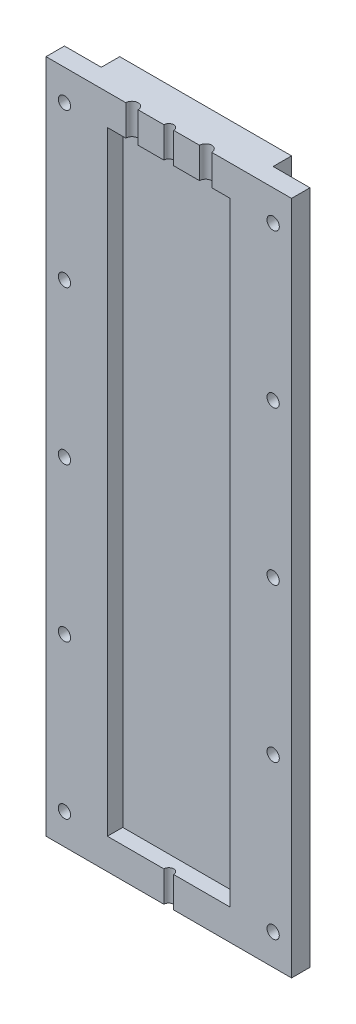
from build123d import *

# Parameters (mm, degrees)
SKETCH1_W           = 28
SKETCH1_H           = 6
BOSS_EXTRUDE1_DEPTH = 105
SKETCH2_W           = 20
SKETCH2_H           = 5
CUT_EXTRUDE1_DEPTH  = 100
SKETCH3_W           = 6
SKETCH3_H           = 3
BOSS_EXTRUDE2_DEPTH = 105
SKETCH6_R           = 0.8
CUT_EXTRUDE4_DEPTH  = 10
BOSS_EXTRUDE3_DEPTH = 5
SKETCH7_R           = 1
CUT_EXTRUDE5_DEPTH  = 10
SKETCH9_R           = 1
CUT_EXTRUDE6_DEPTH  = 5


with BuildPart() as part:
    # Sketch1 → Boss-Extrude1 (new body)
    with BuildSketch(Plane(origin=(0, 0, 0), x_dir=(1, 0, 0), z_dir=(0, 1, 0))):
        with Locations((0, 3)):
            Rectangle(SKETCH1_W, SKETCH1_H)
    extrude(amount=BOSS_EXTRUDE1_DEPTH)

    # Sketch2 → Cut-Extrude1 (cut)
    with BuildSketch(Plane(origin=(0, 105, 0), x_dir=(1, 0, 0), z_dir=(0, 1, 0))):
        Rectangle(SKETCH2_W, SKETCH2_H)
    extrude(amount=-CUT_EXTRUDE1_DEPTH, mode=Mode.SUBTRACT)

    # Sketch3 → Boss-Extrude2 (add)
    with BuildSketch(Plane(origin=(0, 105, 0), x_dir=(1, 0, 0), z_dir=(0, 1, 0))):
        with Locations((17, 1.5)):
            Rectangle(SKETCH3_W, SKETCH3_H)
        with Locations((-17, 1.5)):
            Rectangle(SKETCH3_W, SKETCH3_H)
    extrude(amount=-BOSS_EXTRUDE2_DEPTH)

    # Sketch6 → Cut-Extrude4 (cut)
    with BuildSketch(Plane.XZ):
        Circle(SKETCH6_R)
    extrude(amount=-CUT_EXTRUDE4_DEPTH, mode=Mode.SUBTRACT)

    # Sketch8 → Boss-Extrude3 (add)
    with BuildSketch(Plane(origin=(0, 105, 0), x_dir=(1, 0, 0), z_dir=(0, 1, 0))):
        with BuildLine():
            Line((-0.8, 0), (-10, 0))
            Line((-10, 0), (-20, 0))
            Line((-20, 0), (-20, 3))
            Line((-20, 3), (-14, 3))
            Line((-14, 3), (-14, 6))
            Line((-14, 6), (14, 6))
            Line((14, 6), (14, 3))
            Line((14, 3), (20, 3))
            Line((20, 3), (20, 0))
            Line((20, 0), (10, 0))
            Line((10, 0), (0.8, 0))
            ThreePointArc((0.8, 0), (0, 0.8), (-0.8, 0))
        make_face()
    extrude(amount=BOSS_EXTRUDE3_DEPTH)

    # Sketch7 → Cut-Extrude5 (cut)
    with BuildSketch(Plane(origin=(0, 0, -3), x_dir=(-1, 0, 0), z_dir=(0, 0, -1))):
        with Locations((-17, 5)):
            Circle(SKETCH7_R)
        with Locations((-17, 30)):
            Circle(SKETCH7_R)
        with Locations((-17, 55)):
            Circle(SKETCH7_R)
        with Locations((-17, 80)):
            Circle(SKETCH7_R)
        with Locations((17, 80)):
            Circle(SKETCH7_R)
        with Locations((17, 55)):
            Circle(SKETCH7_R)
        with Locations((17, 30)):
            Circle(SKETCH7_R)
        with Locations((17, 5)):
            Circle(SKETCH7_R)
        with Locations((-17, 105)):
            Circle(SKETCH7_R)
        with Locations((17, 105)):
            Circle(SKETCH7_R)
    extrude(amount=-CUT_EXTRUDE5_DEPTH, mode=Mode.SUBTRACT)

    # Sketch9 → Cut-Extrude6 (cut)
    with BuildSketch(Plane(origin=(0, 110, 0), x_dir=(1, 0, 0), z_dir=(0, 1, 0))):
        with Locations((6, 0)):
            Circle(SKETCH9_R)
        with Locations((-6, 0)):
            Circle(SKETCH9_R)
    extrude(amount=-CUT_EXTRUDE6_DEPTH, mode=Mode.SUBTRACT)


solid = part.part
